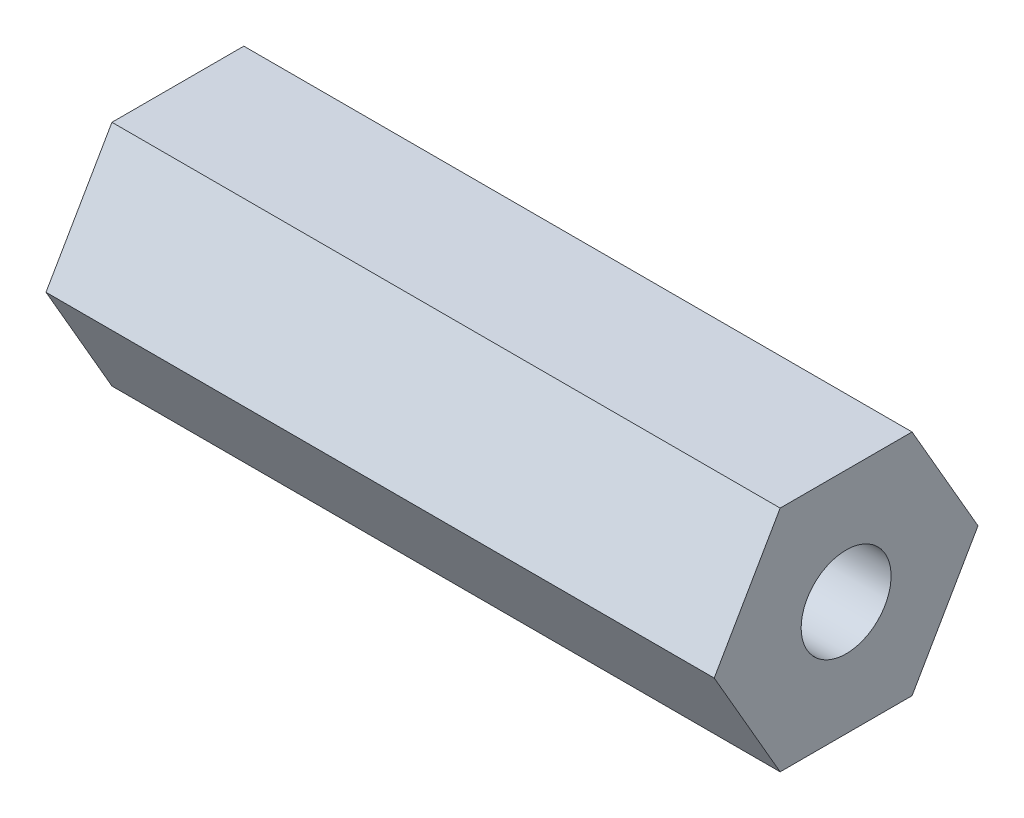
from build123d import *

# Parameters (mm, degrees)
BOSS_EXTRUDE1_DEPTH = 18.575
SKETCH3_R           = 2.5
CUT_EXTRUDE1_DEPTH  = 39.395420734


with BuildPart() as part:
    # Sketch2 → Boss-Extrude1 (new, symmetric)
    with BuildSketch(Plane(origin=(0, 0, 0), x_dir=(0, 0, -1), z_dir=(1, 0, 0))):
        Polygon((7.332348419, 0), (3.666174209, 6.35), (-3.666174209, 6.35), (-7.332348419, 0), (-3.666174209, -6.35), (3.666174209, -6.35), align=None)
    extrude(amount=BOSS_EXTRUDE1_DEPTH, both=True)

    # Sketch3 → Cut-Extrude1 (cut, through all)
    with BuildSketch(Plane.ZY.offset(18.575)):
        Circle(SKETCH3_R)
    extrude(amount=-CUT_EXTRUDE1_DEPTH, mode=Mode.SUBTRACT)


solid = part.part
